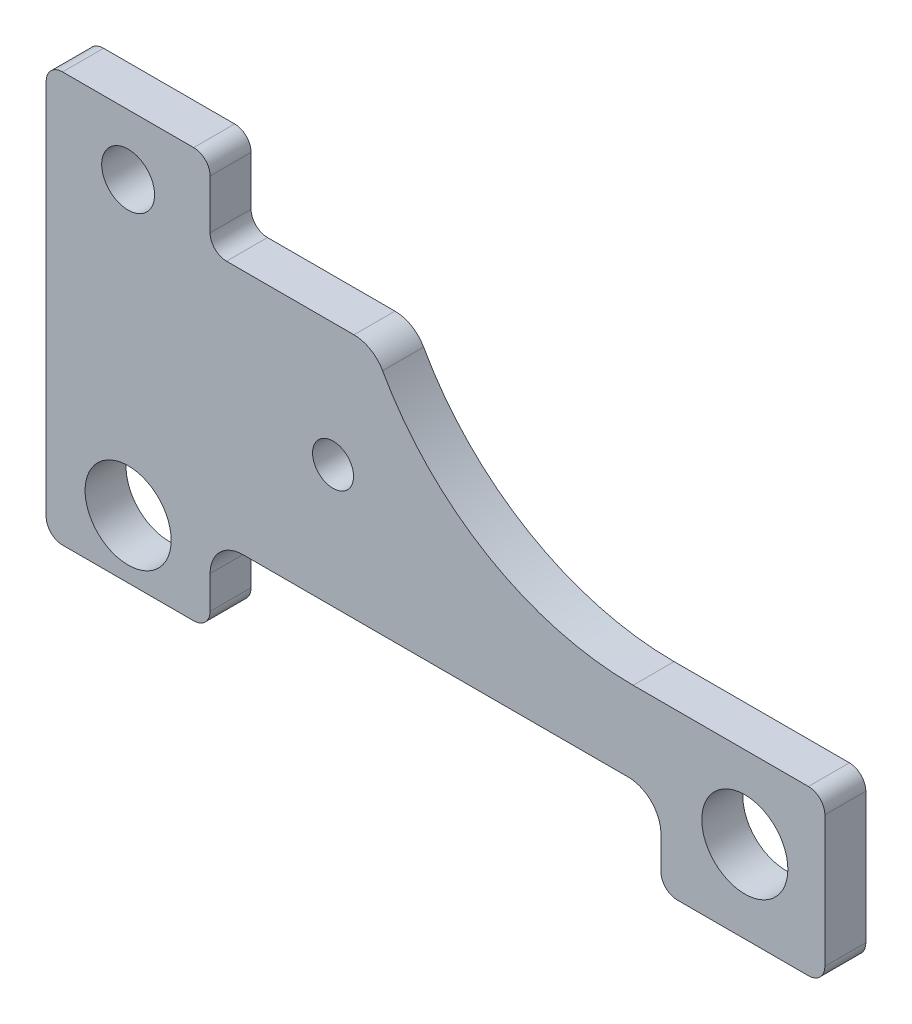
from build123d import *

# Parameters (mm, degrees)
ESBO_O1_R                = 5.25
ESBO_O1_R_2              = 3.225
ESBO_O1_R_3              = 2.5
RESSALTO_EXTRUS_O1_DEPTH = 5


with BuildPart() as part:
    # Esboço1 → Ressalto-extrusão1 (new body)
    with BuildSketch(Plane.XY):
        with BuildLine():
            Line((0.238095238, -10.714285714), (31.238095238, -10.714285714))
            ThreePointArc((31.238095238, -10.714285714), (34.066522363, -11.88585859), (35.238095238, -14.714285714))
            Line((35.238095238, -14.714285714), (35.238095238, -18.714285714))
            ThreePointArc((35.238095238, -18.714285714), (35.823881676, -20.128499277), (37.238095238, -20.714285714))
            Line((37.238095238, -20.714285714), (53.238095238, -20.714285714))
            ThreePointArc((53.238095238, -20.714285714), (54.6523088, -20.128499277), (55.238095238, -18.714285714))
            Line((55.238095238, -18.714285714), (55.238095238, -2.714285714))
            ThreePointArc((55.238095238, -2.714285714), (54.6523088, -1.300072152), (53.238095238, -0.714285714))
            Line((53.238095238, -0.714285714), (31.847818571, -0.714285714))
            ThreePointArc((31.847818571, -0.714285714), (14.124879647, 4.104636838), (1.282253299, 17.234432234))
            ThreePointArc((1.282253299, 17.234432234), (-0.185475427, 18.73498028), (-2.210954161, 19.285714286))
            Line((-2.210954161, 19.285714286), (-17.761904762, 19.285714286))
            ThreePointArc((-17.761904762, 19.285714286), (-19.176118324, 19.871500723), (-19.761904762, 21.285714286))
            Line((-19.761904762, 21.285714286), (-19.761904762, 27.285714286))
            ThreePointArc((-19.761904762, 27.285714286), (-20.3476912, 28.699927848), (-21.761904762, 29.285714286))
            Line((-21.761904762, 29.285714286), (-37.761904762, 29.285714286))
            ThreePointArc((-37.761904762, 29.285714286), (-39.176118324, 28.699927848), (-39.761904762, 27.285714286))
            Line((-39.761904762, 27.285714286), (-39.761904762, -18.714285714))
            ThreePointArc((-39.761904762, -18.714285714), (-39.176118324, -20.128499277), (-37.761904762, -20.714285714))
            Line((-37.761904762, -20.714285714), (-21.761904762, -20.714285714))
            ThreePointArc((-21.761904762, -20.714285714), (-20.3476912, -20.128499277), (-19.761904762, -18.714285714))
            Line((-19.761904762, -18.714285714), (-19.761904762, -14.714285714))
            ThreePointArc((-19.761904762, -14.714285714), (-18.590331887, -11.88585859), (-15.761904762, -10.714285714))
            Line((-15.761904762, -10.714285714), (0.238095238, -10.714285714))
        make_face()
        with Locations((-29.761904762, -13.571428571)):
            Circle(ESBO_O1_R, mode=Mode.SUBTRACT)
        with Locations((-29.761904762, 21.904761905)):
            Circle(ESBO_O1_R_2, mode=Mode.SUBTRACT)
        with Locations((-4.761904762, 4.285714286)):
            Circle(ESBO_O1_R_3, mode=Mode.SUBTRACT)
        with Locations((45.476190476, -10.714285714)):
            Circle(ESBO_O1_R, mode=Mode.SUBTRACT)
    extrude(amount=RESSALTO_EXTRUS_O1_DEPTH)


solid = part.part
